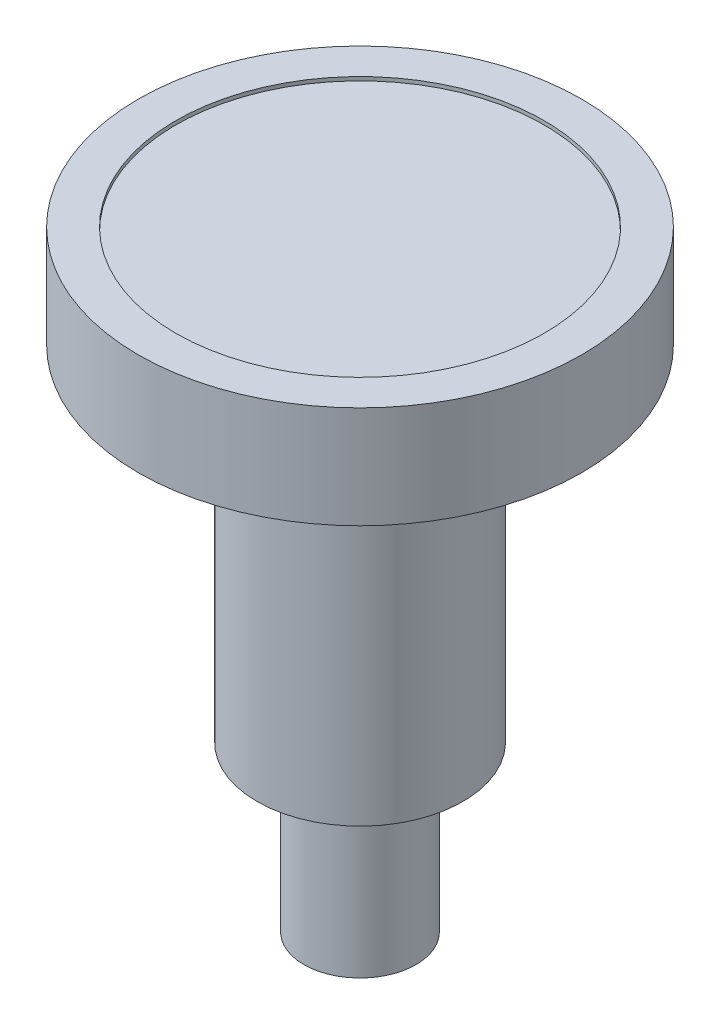
from build123d import *

# Parameters (mm, degrees)
SKETCH1_R           = 1.5
BOSS_EXTRUDE1_DEPTH = 4.4
SKETCH2_R           = 2.75
BOSS_EXTRUDE2_DEPTH = 9.2
SKETCH3_R           = 5.925
BOSS_EXTRUDE3_DEPTH = 2.73
FILLET1_R           = 0.5
SKETCH4_R           = 4.925
CUT_EXTRUDE1_DEPTH  = 0.1


with BuildPart() as part:
    # Sketch1 → Boss-Extrude1 (new body)
    with BuildSketch(Plane(origin=(0, 0, 0), x_dir=(1, 0, 0), z_dir=(0, 1, 0))):
        with Locations(Location((0, 0, 0), (0, 0, 270))):
            Circle(SKETCH1_R)
    extrude(amount=BOSS_EXTRUDE1_DEPTH)

    # Sketch2 → Boss-Extrude2 (add)
    with BuildSketch(Plane(origin=(0, 4.4, 0), x_dir=(1, 0, 0), z_dir=(0, 1, 0))):
        with Locations(Location((0, 0, 0), (0, 0, 270))):
            Circle(SKETCH2_R)
    extrude(amount=BOSS_EXTRUDE2_DEPTH)

    # Sketch3 → Boss-Extrude3 (add)
    with BuildSketch(Plane(origin=(0, 13.6, 0), x_dir=(1, 0, 0), z_dir=(0, 1, 0))):
        with Locations(Location((0, 0, 0), (0, 0, 90))):
            Circle(SKETCH3_R)
    extrude(amount=BOSS_EXTRUDE3_DEPTH)

    # Fillet1
    fillet1_edges = [part.edges().sort_by_distance(p)[0] for p in [
        (0, 13.6, -2.75),
    ]]
    fillet(fillet1_edges, radius=FILLET1_R)

    # Sketch4 → Cut-Extrude1 (cut)
    with BuildSketch(Plane(origin=(0, 16.33, 0), x_dir=(1, 0, 0), z_dir=(0, 1, 0))):
        with Locations(Location((0, 0, 0), (0, 0, 270))):
            Circle(SKETCH4_R)
    extrude(amount=-CUT_EXTRUDE1_DEPTH, mode=Mode.SUBTRACT)


solid = part.part
